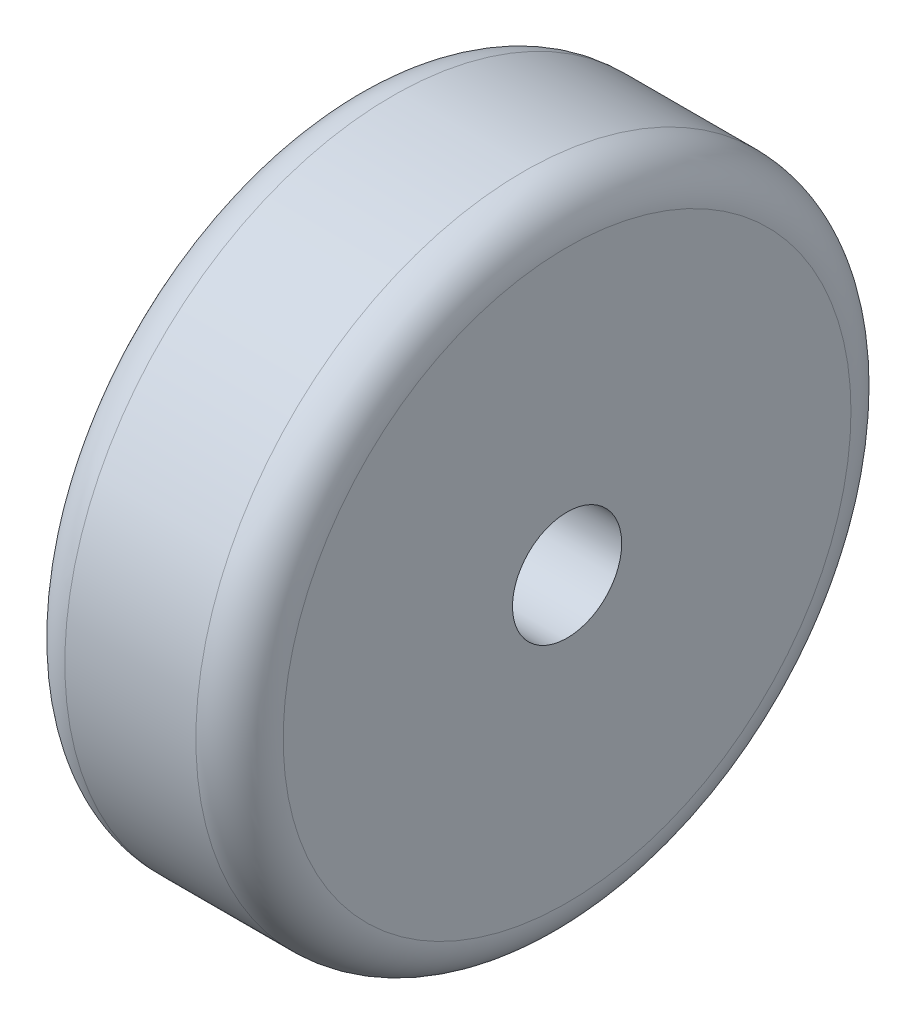
from build123d import *

# Parameters (mm, degrees)
SKETCH1_R           = 38.1
SKETCH1_R_2         = 6.35
BOSS_EXTRUDE1_DEPTH = 25.4
FILLET1_R           = 5.08


with BuildPart() as part:
    # Sketch1 → Boss-Extrude1 (new body)
    with BuildSketch(Plane(origin=(0, 0, 0), x_dir=(0, 0, -1), z_dir=(1, 0, 0))):
        Circle(SKETCH1_R)
        Circle(SKETCH1_R_2, mode=Mode.SUBTRACT)
    extrude(amount=BOSS_EXTRUDE1_DEPTH)

    # Fillet1
    fillet1_edges = [part.edges().sort_by_distance(p)[0] for p in [
        (0, 0, 38.1),
        (25.4, 0, 38.1),
    ]]
    fillet(fillet1_edges, radius=FILLET1_R)


solid = part.part
